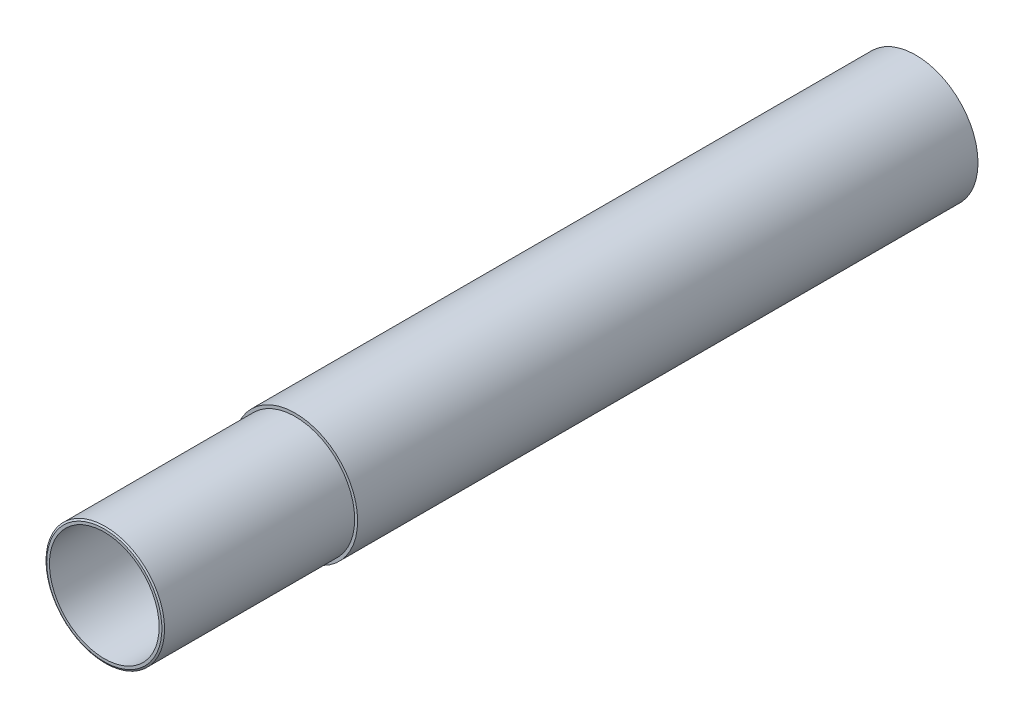
from build123d import *

# Parameters (mm, degrees)
SKETCH3_R           = 33.3375
SKETCH3_R_2         = 29.3751
BOSS_EXTRUDE1_DEPTH = 217.325
SKETCH4_R           = 33.3375
SKETCH4_R_2         = 31.75
CUT_EXTRUDE1_DEPTH  = 102.35


with BuildPart() as part:
    # Sketch3 → Boss-Extrude1 (new, symmetric)
    with BuildSketch(Plane.XY):
        Circle(SKETCH3_R)
        Circle(SKETCH3_R_2, mode=Mode.SUBTRACT)
    extrude(amount=BOSS_EXTRUDE1_DEPTH, both=True)

    # Sketch5 → Cut-Revolve1 (revolve, cut)
    with BuildSketch(Plane(origin=(0, 0, 0), x_dir=(0, 0, -1), z_dir=(1, 0, 0)), mode=Mode.PRIVATE) as cut_revolve1_sk:
        Polygon((-217.325, 30.8375), (-215.881624327, 33.3375), (-217.325, 33.3375), align=None)
    revolve(cut_revolve1_sk.sketch.rotate(Axis((0, 0, 0), (0, 0, 1)), 90), axis=Axis((0, 0, 0), (0, 0, 1)), mode=Mode.SUBTRACT)

    # Sketch4 → Cut-Extrude1 (cut)
    with BuildSketch(Plane.XY.offset(217.325)):
        Circle(SKETCH4_R)
        Circle(SKETCH4_R_2, mode=Mode.SUBTRACT)
    extrude(amount=-CUT_EXTRUDE1_DEPTH, mode=Mode.SUBTRACT)


solid = part.part
